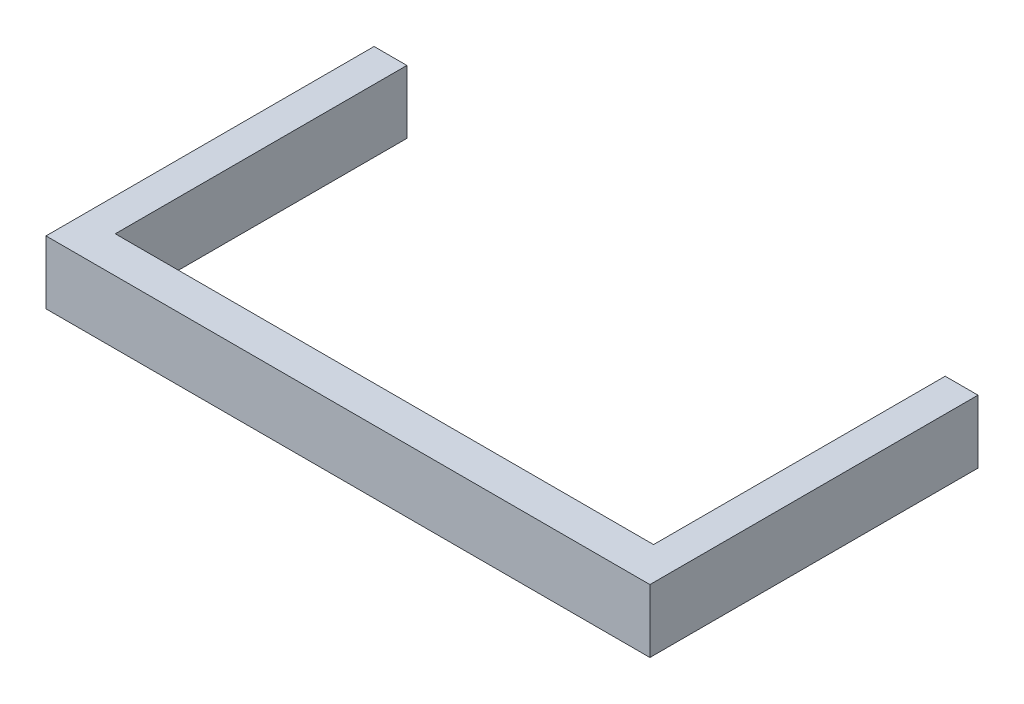
from build123d import *

# Parameters (mm, degrees)
SKETCH1_W           = 2.7
SKETCH1_H           = 5.2
BOSS_EXTRUDE1_DEPTH = 27
SKETCH2_W           = 3
SKETCH2_H           = 5.2
BOSS_EXTRUDE2_DEPTH = 47
SKETCH3_W           = 2.7
SKETCH3_H           = 5.2
BOSS_EXTRUDE3_DEPTH = 24


with BuildPart() as part:
    # Sketch1 → Boss-Extrude1 (new body)
    with BuildSketch(Plane.XY):
        with Locations((1.35, 2.6)):
            Rectangle(SKETCH1_W, SKETCH1_H)
    extrude(amount=BOSS_EXTRUDE1_DEPTH)

    # Sketch2 → Boss-Extrude2 (add)
    with BuildSketch(Plane.ZY):
        with Locations((25.5, 2.6)):
            Rectangle(SKETCH2_W, SKETCH2_H)
    extrude(amount=BOSS_EXTRUDE2_DEPTH)

    # Sketch3 → Boss-Extrude3 (add)
    with BuildSketch(Plane(origin=(0, 0, 24), x_dir=(-1, 0, 0), z_dir=(0, 0, -1))):
        with Locations((45.65, 2.6)):
            Rectangle(SKETCH3_W, SKETCH3_H)
    extrude(amount=BOSS_EXTRUDE3_DEPTH)


solid = part.part
